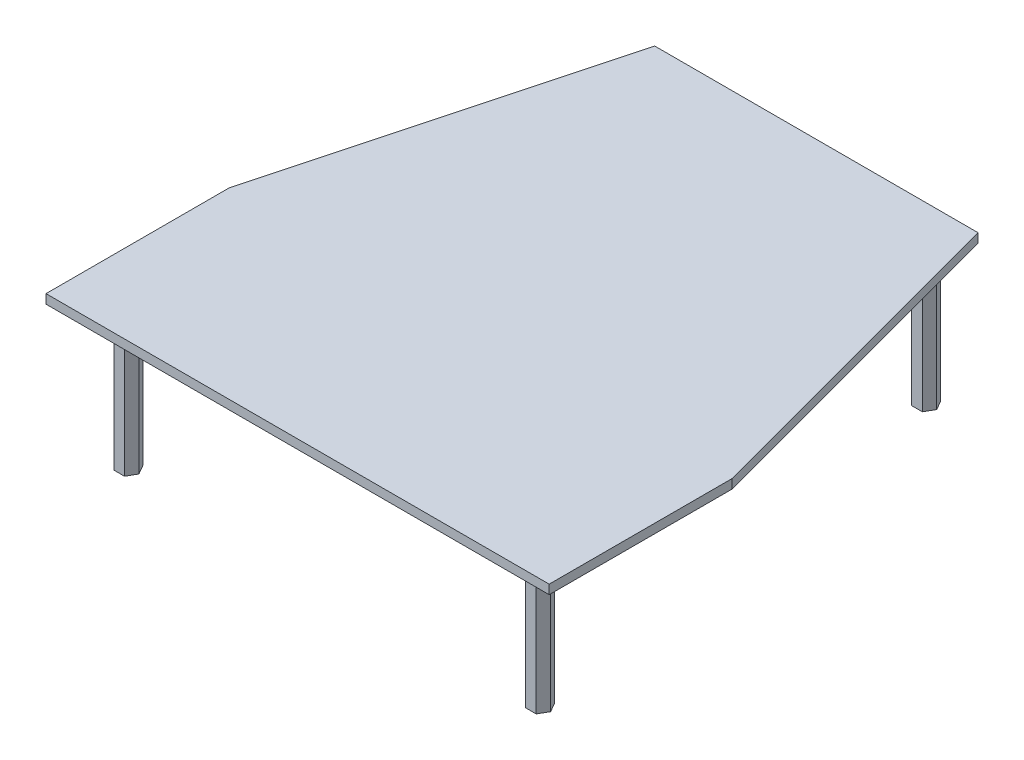
from build123d import *

# Parameters (mm, degrees)
EXTRUDE_1_DEPTH = 1
EXTRUDE_2_DEPTH = 30


with BuildPart() as part:
    # 草图1 → 凸台-拉伸1 (new, symmetric)
    with BuildSketch(Plane(origin=(0, 0, 0), x_dir=(1, 0, 0), z_dir=(0, 1, 0))):
        Polygon((-55, 0), (-55, 40), (-35.329752572, 113.410362798), (35.329752572, 113.410362798), (55, 40), (55, 0), align=None)
    extrude(amount=EXTRUDE_1_DEPTH, both=True)

    # 草图2 → 凸台-拉伸2 (add)
    with BuildSketch(Plane.XZ.offset(1)):
        Polygon((-42.690598923, -8), (-43.845299462, -6), (-46.154700538, -6), (-47.309401077, -8), (-46.154700538, -10), (-43.845299462, -10), align=None)
        Polygon((-27.690598923, -107.410362798), (-28.845299462, -105.410362798), (-31.154700538, -105.410362798), (-32.309401077, -107.410362798), (-31.154700538, -109.410362798), (-28.845299462, -109.410362798), align=None)
        Polygon((28.845299462, -109.410362798), (27.690598923, -107.410362798), (28.845299462, -105.410362798), (31.154700538, -105.410362798), (32.309401077, -107.410362798), (31.154700538, -109.410362798), align=None)
        Polygon((43.845299462, -10), (42.690598923, -8), (43.845299462, -6), (46.154700538, -6), (47.309401077, -8), (46.154700538, -10), align=None)
    extrude(amount=EXTRUDE_2_DEPTH)


solid = part.part
